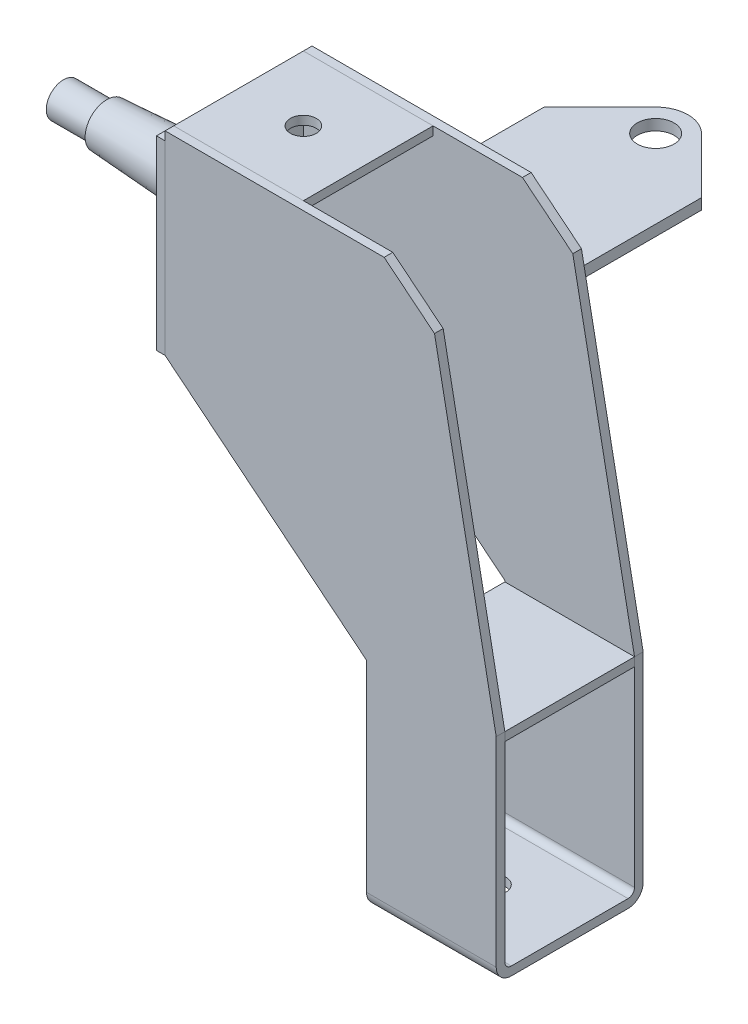
from build123d import *

# Parameters (mm, degrees)
BOSS_EXTRUDE2_DEPTH  = 107
CUT_EXTRUDE1_DEPTH   = 214
SKETCH5_W            = 60
SKETCH5_H            = 4
BOSS_EXTRUDE3_DEPTH  = 60
SKETCH6_W            = 60
SKETCH6_H            = 4
BOSS_EXTRUDE4_DEPTH  = 60
SKETCH7_R            = 3
BOSS_EXTRUDE5_DEPTH  = 4
SKETCH8_W            = 72.723840611
SKETCH8_H            = 5
BOSS_EXTRUDE6_DEPTH  = 100
CHAMFER1_SIZE        = 25
CHAMFER2_SIZE        = 25
SKETCH9_R            = 15
BOSS_EXTRUDE7_DEPTH  = 5
SKETCH10_R           = 12.25
CUT_EXTRUDE2_DEPTH   = 4
CUT_EXTRUDE5_DEPTH   = 8
SKETCH13_R           = 6
CUT_EXTRUDE6_DEPTH   = 10
SKETCH15_R           = 15
BOSS_EXTRUDE8_DEPTH  = 10
SKETCH16_R           = 12.25
BOSS_EXTRUDE9_DEPTH  = 10
SKETCH17_R           = 12.5
BOSS_EXTRUDE10_DEPTH = 77
SKETCH18_R           = 12.5
SKETCH18_R_2         = 8
CUT_EXTRUDE7_DEPTH   = 20
CHAMFER3_SIZE        = 40
CHAMFER3_SIZE2       = 2.5
SKETCH19_R           = 8.5
CUT_EXTRUDE8_DEPTH   = 20


with BuildPart() as part:
    # Sketch3 → Boss-Extrude2 (new, symmetric)
    with BuildSketch(Plane(origin=(0, 0, 0), x_dir=(0, 0, -1), z_dir=(1, 0, 0))):
        with BuildLine():
            Line((93.112387021, -93), (93.112387021, 165.555555556))
            Line((93.112387021, 165.555555556), (89.112387021, 165.555555556))
            Line((89.112387021, 165.555555556), (89.112387021, -93))
            ThreePointArc((89.112387021, -93), (88.233707365, -95.121320344), (86.112387021, -96))
            Line((86.112387021, -96), (32.112387021, -96))
            ThreePointArc((32.112387021, -96), (29.991066678, -95.121320344), (29.112387021, -93))
            Line((29.112387021, -93), (29.112387021, 165.555555556))
            Line((29.112387021, 165.555555556), (25.112387021, 165.555555556))
            Line((25.112387021, 165.555555556), (25.112387021, -93))
            ThreePointArc((25.112387021, -93), (27.162639553, -97.949747468), (32.112387021, -100))
            Line((32.112387021, -100), (86.112387021, -100))
            ThreePointArc((86.112387021, -100), (91.06213449, -97.949747468), (93.112387021, -93))
        make_face()
    extrude(amount=BOSS_EXTRUDE2_DEPTH, both=True)

    # Sketch4 → Cut-Extrude1 (cut)
    with BuildSketch(Plane.XY):
        Polygon((-190, 11.896699378), (-190, -230), (130, -230), (130, -61.975068301), (223.227453171, 13.580487255), (223.227453171, 295.555555556), (-54.204269584, 295.555555556), (-150.061773181, 217.868493514), align=None)
        Polygon((-60, -0.59060332), (-60, -100), (0, -100), (0, 0), (93.227453171, 75.555555556), (93.227453171, 165.555555556), (-8.139740481, 165.555555556), (-31.446603774, 146.666666667), align=None, mode=Mode.SUBTRACT)
    extrude(amount=-CUT_EXTRUDE1_DEPTH, mode=Mode.SUBTRACT)

    # Sketch13 → Cut-Extrude6 (cut)
    with BuildSketch(Plane.XZ.offset(100)):
        with Locations(Location((-23.160596036, -60.439663785, 0), (0, 0, 270))):
            Circle(SKETCH13_R)
    extrude(amount=-CUT_EXTRUDE6_DEPTH, mode=Mode.SUBTRACT)


with BuildPart() as body_2:
    # Sketch5 → Boss-Extrude3 (new body)
    with BuildSketch(Plane(origin=(0, 0, 0), x_dir=(0, 0, -1), z_dir=(1, 0, 0))):
        with Locations((59.112387021, -2.59060332)):
            Rectangle(SKETCH5_W, SKETCH5_H)
    extrude(amount=-BOSS_EXTRUDE3_DEPTH)


with BuildPart() as body_3:
    # Sketch6 → Boss-Extrude4 (new body)
    with BuildSketch(Plane(origin=(93.227453171, 0, 0), x_dir=(0, 0, -1), z_dir=(1, 0, 0))):
        with Locations((59.112387021, 163.555555556)):
            Rectangle(SKETCH6_W, SKETCH6_H)
    extrude(amount=-BOSS_EXTRUDE4_DEPTH)

    # Sketch12 → Cut-Extrude5 (cut)
    with BuildSketch(Plane(origin=(0, 165.555555556, 0), x_dir=(1, 0, 0), z_dir=(0, 1, 0))):
        with BuildLine():
            ThreePointArc((69.227453171, 59.112387021), (65.523553765, 64.655664216), (58.984812484, 63.355027708))
            Line((58.984812484, 63.355027708), (67.470093858, 54.869746334))
            ThreePointArc((67.470093858, 54.869746334), (68.770730366, 56.816286427), (69.227453171, 59.112387021))
        make_face()
        with BuildLine():
            Line((67.470093858, 54.869746334), (58.984812484, 63.355027708))
            ThreePointArc((58.984812484, 63.355027708), (58.984812484, 54.869746334), (67.470093858, 54.869746334))
        make_face()
    extrude(amount=-CUT_EXTRUDE5_DEPTH, mode=Mode.SUBTRACT)


with BuildPart() as body_4:
    # Sketch7 → Boss-Extrude5 (new body)
    with BuildSketch(Plane(origin=(93.227453171, 0, 0), x_dir=(0, 0, -1), z_dir=(1, 0, 0))):
        with BuildLine():
            Line((25.112387021, 161.555555556), (93.112387021, 161.555555556))
            Line((93.112387021, 161.555555556), (93.112387021, 75.555555556))
            Line((93.112387021, 75.555555556), (92.021099136, 75.555555556))
            ThreePointArc((92.021099136, 75.555555556), (89.320790512, 74.763682613), (87.475802422, 72.638888889))
            ThreePointArc((87.475802422, 72.638888889), (81.112387021, 68.555555556), (74.748971621, 72.638888889))
            ThreePointArc((74.748971621, 72.638888889), (72.903983531, 74.763682613), (70.203674907, 75.555555556))
            Line((70.203674907, 75.555555556), (48.021099136, 75.555555556))
            ThreePointArc((48.021099136, 75.555555556), (45.320790512, 74.763682613), (43.475802422, 72.638888889))
            ThreePointArc((43.475802422, 72.638888889), (37.112387021, 68.555555556), (30.748971621, 72.638888889))
            ThreePointArc((30.748971621, 72.638888889), (28.903983531, 74.763682613), (26.203674907, 75.555555556))
            Line((26.203674907, 75.555555556), (25.112387021, 75.555555556))
            Line((25.112387021, 75.555555556), (25.112387021, 161.555555556))
        make_face()
        with Locations((37.112387021, 155.082134103)):
            Circle(SKETCH7_R, mode=Mode.SUBTRACT)
        with Locations((81.112387021, 155.082134103)):
            Circle(SKETCH7_R, mode=Mode.SUBTRACT)
        with Locations((37.112387021, 75.555555556)):
            Circle(SKETCH7_R, mode=Mode.SUBTRACT)
        with Locations((81.112387021, 75.555555556)):
            Circle(SKETCH7_R, mode=Mode.SUBTRACT)
    extrude(amount=BOSS_EXTRUDE5_DEPTH)

    # Sketch10 → Cut-Extrude2 (cut)
    with BuildSketch(Plane(origin=(97.227453171, 0, 0), x_dir=(0, 0, -1), z_dir=(1, 0, 0))):
        with Locations((59.112387021, 120.555555556)):
            Circle(SKETCH10_R)
    extrude(amount=-CUT_EXTRUDE2_DEPTH, mode=Mode.SUBTRACT)


with BuildPart() as body_5:
    # Sketch8 → Boss-Extrude6 (new body)
    with BuildSketch(Plane(origin=(0, 0, -93.112387021), x_dir=(-1, 0, 0), z_dir=(0, 0, -1))):
        with Locations((-24.25985796, 117.5)):
            Rectangle(SKETCH8_W, SKETCH8_H)
    extrude(amount=BOSS_EXTRUDE6_DEPTH)

    # Chamfer1
    chamfer1_edges = [body_5.edges().sort_by_distance(p)[0] for p in [
        (-12.102062346, 117.5, -193.112387021),
    ]]
    chamfer(chamfer1_edges, length=CHAMFER1_SIZE)

    # Chamfer2
    chamfer2_edges = [body_5.edges().sort_by_distance(p)[0] for p in [
        (60.621778265, 117.5, -193.112387021),
    ]]
    chamfer(chamfer2_edges, length=CHAMFER2_SIZE)

    # Sketch9 → Boss-Extrude7 (add)
    with BuildSketch(Plane.XZ.offset(-115)):
        with Locations((24.221778265, -183.112387021)):
            Circle(SKETCH9_R)
    extrude(amount=-BOSS_EXTRUDE7_DEPTH)

    # Sketch19 → Cut-Extrude8 (cut)
    with BuildSketch(Plane.XZ.offset(-115)):
        with Locations((24.221778265, -183.112387021)):
            Circle(SKETCH19_R)
    extrude(amount=-CUT_EXTRUDE8_DEPTH, mode=Mode.SUBTRACT)


with BuildPart() as body_6:
    # Sketch15 → Boss-Extrude8 (new body)
    with BuildSketch(Plane.ZY.offset(-93.227453171)):
        with Locations((-59.112387021, 120.555555556)):
            Circle(SKETCH15_R)
    extrude(amount=BOSS_EXTRUDE8_DEPTH)


with BuildPart() as body_7:
    # Sketch16 → Boss-Extrude9 (new body)
    with BuildSketch(Plane(origin=(97.227453171, 0, 0), x_dir=(0, 0, -1), z_dir=(1, 0, 0))):
        with Locations((59.112387021, 120.555555556)):
            Circle(SKETCH16_R)
    extrude(amount=-BOSS_EXTRUDE9_DEPTH)


with BuildPart() as body_8:
    # Sketch17 → Boss-Extrude10 (new body)
    with BuildSketch(Plane(origin=(97.227453171, 0, 0), x_dir=(0, 0, -1), z_dir=(1, 0, 0))):
        with Locations((59.112387021, 120.555555556)):
            Circle(SKETCH17_R)
    extrude(amount=BOSS_EXTRUDE10_DEPTH)

    # Sketch18 → Cut-Extrude7 (cut)
    with BuildSketch(Plane(origin=(174.227453171, 0, 0), x_dir=(0, 0, -1), z_dir=(1, 0, 0))):
        with Locations((59.112387021, 120.555555556)):
            Circle(SKETCH18_R)
        with Locations((59.112387021, 120.555555556)):
            Circle(SKETCH18_R_2, mode=Mode.SUBTRACT)
    extrude(amount=-CUT_EXTRUDE7_DEPTH, mode=Mode.SUBTRACT)

    # Chamfer3
    chamfer3_edges = [body_8.edges().sort_by_distance(p)[0] for p in [
        (154.227453171, 120.555555556, -46.612387021),
    ]]
    chamfer3_side = [body_8.faces().sort_by_distance(p)[0] for p in [
        (125.727453171, 120.555555556, -46.612387021),
    ]]
    chamfer(chamfer3_edges, length=CHAMFER3_SIZE, length2=CHAMFER3_SIZE2, reference=chamfer3_side[0])

    # Combine1: union body 7, body 6
    add(body_7.part)
    add(body_6.part)


with BuildPart() as body_7_2:
    # Mirror1: mirrored copy
    add(body_3.part.mirror(Plane(origin=(-100, 0, 0), x_dir=(0, 0, 1), z_dir=(1, 0, 0))))


with BuildPart() as body_8_2:
    # Mirror1 2: mirrored copy
    add(part.part.mirror(Plane(origin=(-100, 0, 0), x_dir=(0, 0, 1), z_dir=(1, 0, 0))))


with BuildPart() as body_9:
    # Mirror1 3: mirrored copy
    add(body_2.part.mirror(Plane(origin=(-100, 0, 0), x_dir=(0, 0, 1), z_dir=(1, 0, 0))))


with BuildPart() as body_10:
    # Mirror1 4: mirrored copy
    add(body_8.part.mirror(Plane(origin=(-100, 0, 0), x_dir=(0, 0, 1), z_dir=(1, 0, 0))))


with BuildPart() as body_11:
    # Mirror1 5: mirrored copy
    add(body_5.part.mirror(Plane(origin=(-100, 0, 0), x_dir=(0, 0, 1), z_dir=(1, 0, 0))))


with BuildPart() as body_12:
    # Mirror1 6: mirrored copy
    add(body_4.part.mirror(Plane(origin=(-100, 0, 0), x_dir=(0, 0, 1), z_dir=(1, 0, 0))))


solid = Compound([body_7_2.part, body_8_2.part, body_9.part, body_10.part, body_11.part, body_12.part])
